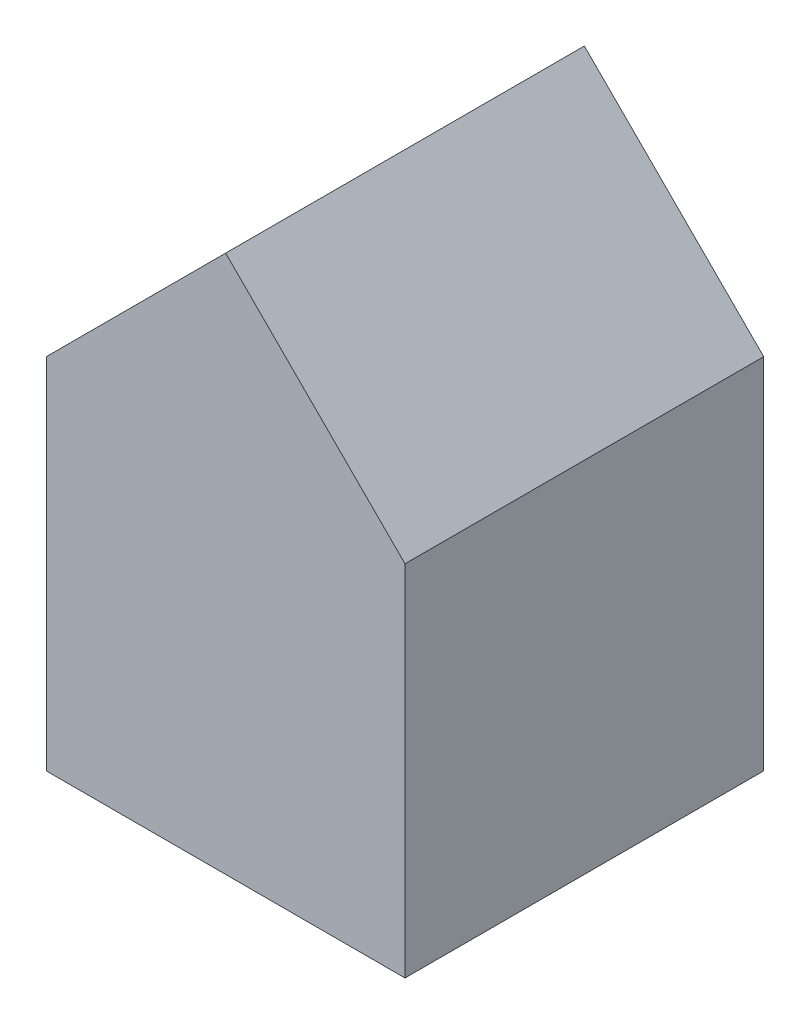
from build123d import *

# Parameters (mm, degrees)
BOSS_EXTRUDE1_DEPTH = 10


with BuildPart() as part:
    # Sketch1 → Boss-Extrude1 (new body)
    with BuildSketch(Plane.XY):
        Polygon((0, 0), (10, 0), (10, 10), (5, 15), (0, 10), align=None)
    extrude(amount=BOSS_EXTRUDE1_DEPTH)


solid = part.part
